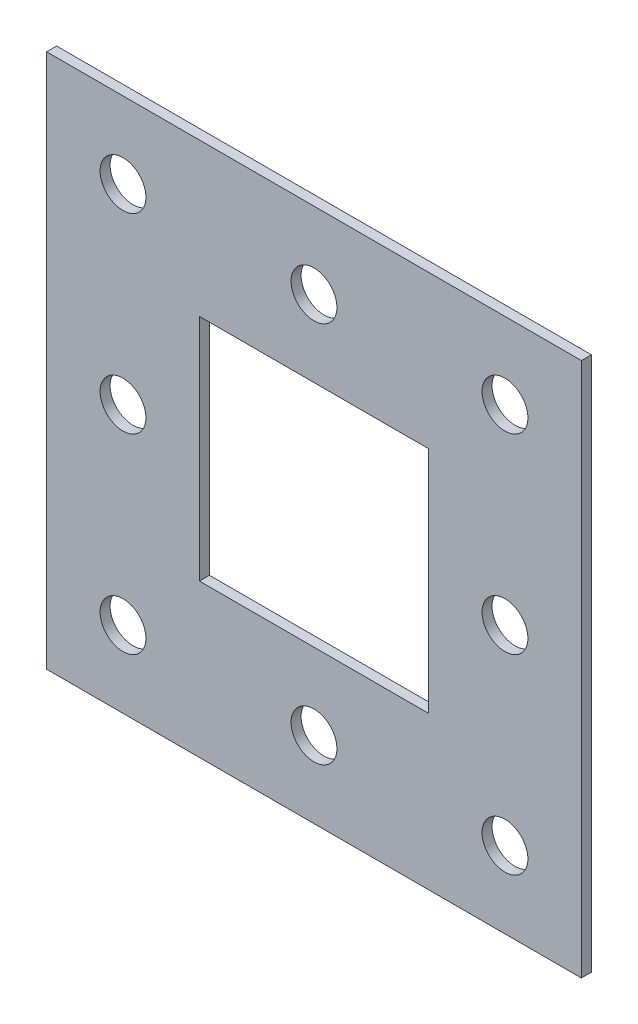
from build123d import *

# Parameters (mm, degrees)
SKETCH3_W               = 70
SKETCH3_H               = 70
BOSS_EXTRUDE2_DEPTH     = 1.31
CUT_EXTRUDE1_DEPTH      = 3.08
CUT_EXTRUDE1_DEPTH_BACK = 31
SKETCH4_R               = 3
SKETCH4_W               = 30
SKETCH4_H               = 30


with BuildPart() as part:
    # Sketch3 → Boss-Extrude2 (new body)
    with BuildSketch(Plane.XY):
        Rectangle(SKETCH3_W, SKETCH3_H)
    extrude(amount=BOSS_EXTRUDE2_DEPTH)

    # Sketch4 → Cut-Extrude1 (cut, two sides: drawn at the far end of the back side and taken through both)
    with BuildSketch(Plane.XY.offset(1.31).offset(-CUT_EXTRUDE1_DEPTH_BACK)):
        with Locations(Location((-25, 25, 0), (0, 0, 180))):
            Circle(SKETCH4_R)
        with Locations(Location((0, 25, 0), (0, 0, 180))):
            Circle(SKETCH4_R)
        with Locations(Location((25, 25, 0), (0, 0, 180))):
            Circle(SKETCH4_R)
        with Locations(Location((25, 0, 0), (0, 0, 180))):
            Circle(SKETCH4_R)
        with Locations(Location((25, -25, 0), (0, 0, 180))):
            Circle(SKETCH4_R)
        with Locations(Location((0, -25, 0), (0, 0, 180))):
            Circle(SKETCH4_R)
        with Locations(Location((-25, -25, 0), (0, 0, 180))):
            Circle(SKETCH4_R)
        with Locations(Location((-25, 0, 0), (0, 0, 180))):
            Circle(SKETCH4_R)
        Rectangle(SKETCH4_W, SKETCH4_H)
    extrude(amount=CUT_EXTRUDE1_DEPTH + CUT_EXTRUDE1_DEPTH_BACK, mode=Mode.SUBTRACT)


solid = part.part
